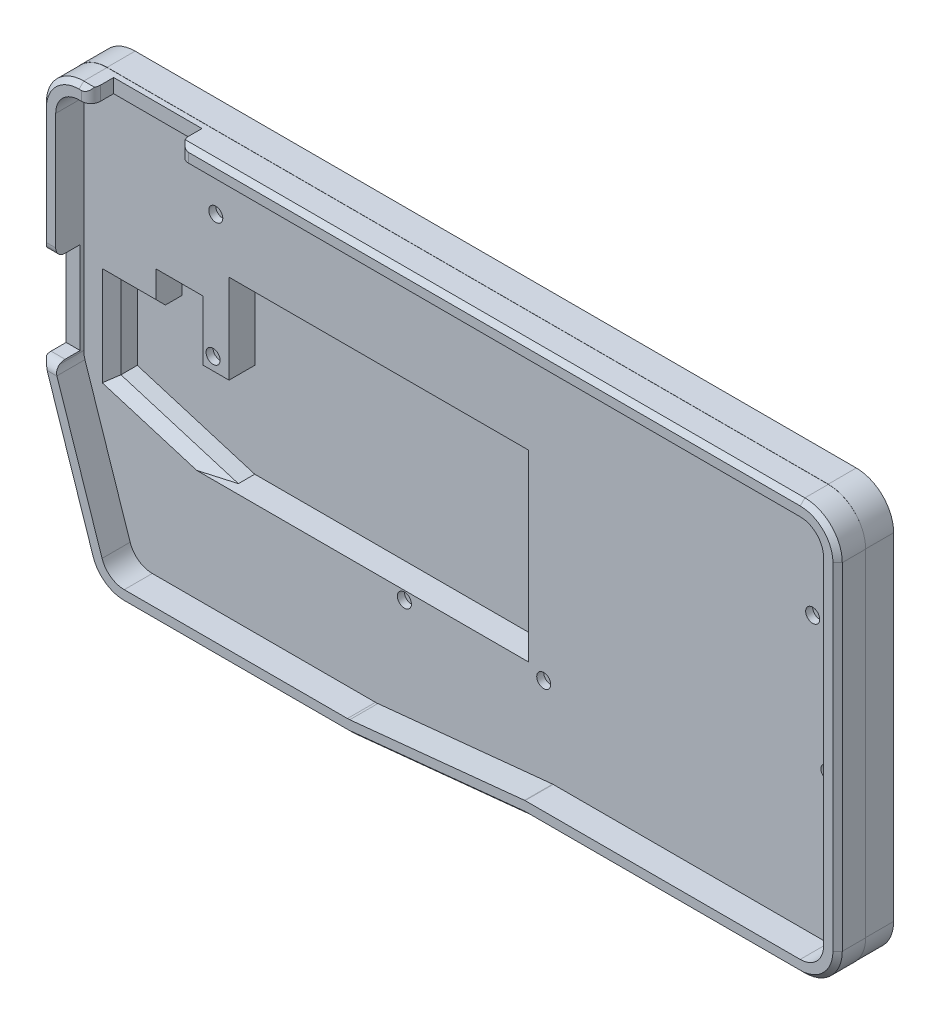
from build123d import *

# Parameters (mm, degrees)
BOSS_EXTRUDE1_DEPTH = 6
SKETCH4_R           = 1
BOSS_EXTRUDE2_DEPTH = 6
SKETCH5_W           = 18.416924118
SKETCH5_H           = 14.207341462
SKETCH5_W_2         = 7.542168924
CUT_EXTRUDE2_DEPTH  = 5.5
BOSS_EXTRUDE3_START = -5.5
SKETCH6_R           = 1
BOSS_EXTRUDE3_DEPTH = 5.5
SKETCH7_R           = 1.5
CUT_EXTRUDE3_DEPTH  = 1.5
SKETCH8_R           = 6
CUT_EXTRUDE4_DEPTH  = 2.5
CHAMFER1_SIZE       = 1
SKETCH9_W           = 18.892930983
SKETCH9_H           = 5.861361118
CUT_EXTRUDE5_DEPTH  = 5
FILLET1_R           = 2
SKETCH10_W          = 6.781572577
SKETCH10_H          = 19.62380987
CUT_EXTRUDE6_DEPTH  = 5
FILLET2_R           = 2
SKETCH11_W          = 9.997758807
SKETCH11_H          = 15.961334235
CUT_EXTRUDE7_DEPTH  = 5.5
SKETCH12_W          = 64.020736218
SKETCH12_H          = 3.376126478
BOSS_EXTRUDE4_DEPTH = 5.5
CUT_EXTRUDE8_DEPTH  = 5.5
CHAMFER2_SIZE       = 2
CHAMFER3_SIZE       = 2
CHAMFER4_SIZE       = 2


with BuildPart() as part:
    # Sketch3 → Boss-Extrude1 (new body)
    with BuildSketch(Plane.XY):
        with BuildLine():
            Line((-83.698447841, 57.444573542), (70.551552159, 57.348317742))
            ThreePointArc((70.551552159, 57.348317742), (76.205179029, 55.0034083), (78.546560098, 49.348319285))
            Line((78.546560098, 49.348319285), (78.546560098, -22.653552215))
            ThreePointArc((78.546560098, -22.653552215), (76.203414347, -28.310406464), (70.546560098, -30.653552215))
            Line((70.546560098, -30.653552215), (11.797913198, -30.653552215))
            Line((11.797913198, -30.653552215), (-25.501951002, -34.413220215))
            ThreePointArc((-25.501951002, -34.413220215), (-25.902594791, -34.443462903), (-26.304251697, -34.453552282))
            Line((-26.304251697, -34.453552282), (-74.041162197, -34.453552282))
            ThreePointArc((-74.041162197, -34.453552282), (-78.718844372, -32.943489837), (-81.6306285, -28.983374648))
            Line((-81.6306285, -28.983374648), (-91.292906294, 0.003458516))
            ThreePointArc((-91.292906294, 0.003458516), (-91.600139587, 1.251822731), (-91.703439931, 2.53328071))
            Line((-91.703439931, 2.53328071), (-91.703439931, 49.44457511))
            ThreePointArc((-91.703439931, 49.44457511), (-89.358528934, 55.103194051), (-83.698447841, 57.444573542))
        make_face()
        with BuildLine():
            Line((-83.700319941, 54.444574123), (70.549680059, 54.348318323))
            ThreePointArc((70.549680059, 54.348318323), (74.083196904, 52.882749939), (75.546560095, 49.348319271))
            Line((75.546560095, 49.348319271), (75.546560095, -22.653552229))
            ThreePointArc((75.546560095, -22.653552229), (74.082093996, -26.189086124), (70.546560098, -27.653552212))
            Line((70.546560098, -27.653552212), (11.697371898, -27.653552212))
            ThreePointArc((11.697371898, -27.653552212), (11.64716478, -27.654813402), (11.597084303, -27.658593757))
            Line((11.597084303, -27.658593757), (-25.802813799, -31.428344747))
            ThreePointArc((-25.802813799, -31.428344747), (-26.053216149, -31.447246424), (-26.304251697, -31.453552285))
            Line((-26.304251697, -31.453552285), (-74.041162197, -31.453552285))
            ThreePointArc((-74.041162197, -31.453552285), (-76.964713558, -30.509763257), (-78.784578638, -28.034691263))
            Line((-78.784578638, -28.034691263), (-88.446856397, 0.952141815))
            ThreePointArc((-88.446856397, 0.952141815), (-88.638877211, 1.732369461), (-88.703439928, 2.53328071))
            Line((-88.703439928, 2.53328071), (-88.703439928, 49.44457511))
            ThreePointArc((-88.703439928, 49.44457511), (-87.237870579, 52.981211921), (-83.700319941, 54.444574123))
        make_face(mode=Mode.SUBTRACT)
    extrude(amount=BOSS_EXTRUDE1_DEPTH)

    # Sketch4 → Boss-Extrude2 (add)
    # profile 1 of 2: a face of its own
    with BuildSketch(Plane.XY):
        with BuildLine():
            Line((-83.709120873, 57.479155754), (70.540879127, 57.382899954))
            ThreePointArc((70.540879127, 57.382899954), (76.194505997, 55.037990512), (78.535887066, 49.382901497))
            Line((78.535887066, 49.382901497), (78.535887066, -22.618970003))
            ThreePointArc((78.535887066, -22.618970003), (76.192741315, -28.275824252), (70.535887066, -30.618970003))
            Line((70.535887066, -30.618970003), (11.787240166, -30.618970003))
            Line((11.787240166, -30.618970003), (-25.512624034, -34.378638003))
            ThreePointArc((-25.512624034, -34.378638003), (-25.913267823, -34.408880691), (-26.314924729, -34.41897007))
            Line((-26.314924729, -34.41897007), (-74.051835229, -34.41897007))
            ThreePointArc((-74.051835229, -34.41897007), (-78.729517404, -32.908907625), (-81.641301532, -28.948792436))
            Line((-81.641301532, -28.948792436), (-91.303579326, 0.038040728))
            ThreePointArc((-91.303579326, 0.038040728), (-91.610812619, 1.286404943), (-91.714112963, 2.567862922))
            Line((-91.714112963, 2.567862922), (-91.714112963, 49.479157322))
            ThreePointArc((-91.714112963, 49.479157322), (-89.369201966, 55.137776263), (-83.709120873, 57.479155754))
        make_face()
        with BuildLine():
            ThreePointArc((-83.710992973, 54.479156335), (-87.248543611, 53.015794133), (-88.71411296, 49.479157322))
            Line((-88.71411296, 49.479157322), (-88.71411296, 2.567862922))
            ThreePointArc((-88.71411296, 2.567862922), (-88.649550243, 1.766951673), (-88.457529429, 0.986724027))
            Line((-88.457529429, 0.986724027), (-78.79525167, -28.000109051))
            ThreePointArc((-78.79525167, -28.000109051), (-76.97538659, -30.475181045), (-74.051835229, -31.418970073))
            Line((-74.051835229, -31.418970073), (-26.314924729, -31.418970073))
            ThreePointArc((-26.314924729, -31.418970073), (-26.063889181, -31.412664212), (-25.813486831, -31.393762535))
            Line((-25.813486831, -31.393762535), (11.586411271, -27.624011544))
            ThreePointArc((11.586411271, -27.624011544), (11.636491748, -27.62023119), (11.686698866, -27.61897))
            Line((11.686698866, -27.61897), (70.535887066, -27.61897))
            ThreePointArc((70.535887066, -27.61897), (74.071420964, -26.154503912), (75.535887062, -22.618970017))
            Line((75.535887062, -22.618970017), (75.535887062, 49.382901483))
            ThreePointArc((75.535887062, 49.382901483), (74.072523872, 52.917332152), (70.539007027, 54.382900535))
            Line((70.539007027, 54.382900535), (-83.710992973, 54.479156335))
        make_face(mode=Mode.SUBTRACT)
    # profile 2 of 2: a face of its own
    with BuildSketch(Plane.XY):
        with BuildLine():
            Line((-83.710992973, 54.479156335), (70.539007027, 54.382900535))
            ThreePointArc((70.539007027, 54.382900535), (74.072523872, 52.917332152), (75.535887062, 49.382901483))
            Line((75.535887062, 49.382901483), (75.535887062, -22.618970017))
            ThreePointArc((75.535887062, -22.618970017), (74.071420964, -26.154503912), (70.535887066, -27.61897))
            Line((70.535887066, -27.61897), (11.686698866, -27.61897))
            ThreePointArc((11.686698866, -27.61897), (11.636491748, -27.62023119), (11.586411271, -27.624011544))
            Line((11.586411271, -27.624011544), (-25.813486831, -31.393762535))
            ThreePointArc((-25.813486831, -31.393762535), (-26.063889181, -31.412664212), (-26.314924729, -31.418970073))
            Line((-26.314924729, -31.418970073), (-74.051835229, -31.418970073))
            ThreePointArc((-74.051835229, -31.418970073), (-76.97538659, -30.475181045), (-78.79525167, -28.000109051))
            Line((-78.79525167, -28.000109051), (-88.457529429, 0.986724027))
            ThreePointArc((-88.457529429, 0.986724027), (-88.649550243, 1.766951673), (-88.71411296, 2.567862922))
            Line((-88.71411296, 2.567862922), (-88.71411296, 49.479157322))
            ThreePointArc((-88.71411296, 49.479157322), (-87.248543611, 53.015794133), (-83.710992973, 54.479156335))
        make_face()
        with Locations((67.215887037, 31.431029922)):
            Circle(SKETCH4_R, mode=Mode.SUBTRACT)
        with Locations((70.485887037, 3.881029922)):
            Circle(SKETCH4_R, mode=Mode.SUBTRACT)
        with Locations((9.685887037, -9.418970078)):
            Circle(SKETCH4_R, mode=Mode.SUBTRACT)
        with Locations((-20.114112963, -9.418970078)):
            Circle(SKETCH4_R, mode=Mode.SUBTRACT)
        with Locations((-61.034112963, 15.281029922)):
            Circle(SKETCH4_R, mode=Mode.SUBTRACT)
        with Locations((-60.464112963, 41.881029922)):
            Circle(SKETCH4_R, mode=Mode.SUBTRACT)
    extrude(amount=-BOSS_EXTRUDE2_DEPTH)

    # Sketch5 → Cut-Extrude2 (cut)
    with BuildSketch(Plane.XY):
        with Locations((-66.833428189, 5.461527447)):
            Rectangle(SKETCH5_W, SKETCH5_H)
        with Locations((-53.853881668, 5.461527447)):
            Rectangle(SKETCH5_W_2, SKETCH5_H)
        Polygon((6.395770088, 35.016305674), (-57.62496613, 35.016305674), (-57.62496613, 12.565198178), (-50.082797206, 12.565198178), (-50.082797206, -1.642143284), (-57.62496613, -1.642143284), (-57.62496613, -7.605718712), (6.395770088, -7.605718712), align=None)
    extrude(amount=-CUT_EXTRUDE2_DEPTH, mode=Mode.SUBTRACT)

    # Sketch6 → Boss-Extrude3 (add)
    with BuildSketch(Plane(origin=(0, 0, -6), x_dir=(-1, 0, 0), z_dir=(0, 0, -1)).offset(BOSS_EXTRUDE3_START)):
        with Locations(Location((-67.215887037, 31.431029922, 0), (0, 0, 180))):
            Circle(SKETCH6_R)
        with Locations(Location((-70.485887037, 3.881029922, 0), (0, 0, 180))):
            Circle(SKETCH6_R)
        with Locations(Location((-9.685887037, -9.418970078, 0), (0, 0, 180))):
            Circle(SKETCH6_R)
        with Locations(Location((20.114112963, -9.418970078, 0), (0, 0, 180))):
            Circle(SKETCH6_R)
        with Locations(Location((61.034112963, 15.281029922, 0), (0, 0, 180))):
            Circle(SKETCH6_R)
        with Locations(Location((60.464112963, 41.881029922, 0), (0, 0, 180))):
            Circle(SKETCH6_R)
    extrude(amount=BOSS_EXTRUDE3_DEPTH)

    # Sketch7 → Cut-Extrude3 (cut)
    with BuildSketch(Plane.XY):
        with Locations((-60.464112963, 41.881029922)):
            Circle(SKETCH7_R)
        with Locations((-61.034112963, 15.281029922)):
            Circle(SKETCH7_R)
        with Locations((-20.114112963, -9.418970078)):
            Circle(SKETCH7_R)
        with Locations((9.685887037, -9.418970078)):
            Circle(SKETCH7_R)
        with Locations((70.485887037, 3.881029922)):
            Circle(SKETCH7_R)
        with Locations((67.215887037, 31.431029922)):
            Circle(SKETCH7_R)
    extrude(amount=-CUT_EXTRUDE3_DEPTH, mode=Mode.SUBTRACT)

    # Sketch8 → Cut-Extrude4 (cut)
    with BuildSketch(Plane(origin=(0, 0, -6), x_dir=(-1, 0, 0), z_dir=(0, 0, -1))):
        with Locations((-70.535887037, 49.382901483)):
            Circle(SKETCH8_R)
        with Locations((-70.535887037, -22.163858729)):
            Circle(SKETCH8_R)
        with Locations((83.75945845, 49.382901483)):
            Circle(SKETCH8_R)
        with Locations((73.586300366, -25.671844276)):
            Circle(SKETCH8_R)
    extrude(amount=-CUT_EXTRUDE4_DEPTH, mode=Mode.SUBTRACT)

    # Chamfer1
    chamfer1_edges = [part.edges().sort_by_distance(p)[0] for p in [
        (-91.600139587, 1.251822731, 6),
        (-86.461767397, -14.489958066, 6),
        (-78.718844372, -32.943489837, 6),
        (-50.172706947, -34.453552282, 6),
        (-25.902594791, -34.443462903, 6),
        (-6.852018902, -32.533386215, 6),
        (41.172236648, -30.653552215, 6),
        (76.203414347, -28.310406464, 6),
        (78.546560098, 13.347383535, 6),
        (76.205179029, 55.0034083, 6),
        (-89.358528934, 55.103194051, 6),
        (-6.573447841, 57.396445642, 6),
        (-91.703439931, 25.98892791, 6),
    ]]
    chamfer(chamfer1_edges, length=CHAMFER1_SIZE)

    # Sketch9 → Cut-Extrude5 (cut)
    with BuildSketch(Plane(origin=(0.035814222, 57.392321299, 0), x_dir=(0.9999998052966842, -0.0006240245138326787, 0), z_dir=(0.0006240245138326787, 0.9999998052966842, 0))):
        with Locations((-71.746565454, -4.083255452)):
            Rectangle(SKETCH9_W, SKETCH9_H)
    extrude(amount=-CUT_EXTRUDE5_DEPTH, mode=Mode.SUBTRACT)

    # Fillet1
    fillet1_edges = [part.edges().sort_by_distance(p)[0] for p in [
        (-62.265521659, 55.431198477, 6),
        (-81.158448963, 55.442988129, 6),
    ]]
    fillet(fillet1_edges, radius=FILLET1_R)

    # Sketch10 → Cut-Extrude6 (cut)
    with BuildSketch(Plane.ZY.offset(91.703439931)):
        with Locations((4.158048933, 12.711198082)):
            Rectangle(SKETCH10_W, SKETCH10_H)
    extrude(amount=-CUT_EXTRUDE6_DEPTH, mode=Mode.SUBTRACT)

    # Fillet2
    fillet2_edges = [part.edges().sort_by_distance(p)[0] for p in [
        (-89.703439929, 2.899293147, 6),
        (-89.703439929, 22.523103017, 6),
    ]]
    fillet(fillet2_edges, radius=FILLET2_R)

    # Sketch11 → Cut-Extrude7 (cut)
    with BuildSketch(Plane.XY):
        with Locations((-68.236622408, 17.388678305)):
            Rectangle(SKETCH11_W, SKETCH11_H)
    extrude(amount=-CUT_EXTRUDE7_DEPTH, mode=Mode.SUBTRACT)

    # Sketch12 → Boss-Extrude4 (add)
    with BuildSketch(Plane.XY.offset(-5.5)):
        with Locations((-25.614598021, 33.328242435)):
            Rectangle(SKETCH12_W, SKETCH12_H)
    extrude(amount=BOSS_EXTRUDE4_DEPTH)

    # Sketch13 → Cut-Extrude8 (cut)
    with BuildSketch(Plane.XY):
        Polygon((-82.744925302, 17.678852462), (-82.744925302, 0), (-57.62496613, -7.605718712), (-57.62496613, -1.642143284), (-76.041890248, -1.642143284), (-76.041890248, 12.565198178), (-73.235501811, 12.565198178), (-73.235501811, 17.678852462), align=None)
    extrude(amount=-CUT_EXTRUDE8_DEPTH, mode=Mode.SUBTRACT)

    # Chamfer2
    chamfer2_edges = [part.edges().sort_by_distance(p)[0] for p in [
        (-82.744925302, 8.839426231, 0),
    ]]
    chamfer(chamfer2_edges, length=CHAMFER2_SIZE)

    # Chamfer3
    chamfer3_edges = [part.edges().sort_by_distance(p)[0] for p in [
        (-78.990213556, 17.678852462, 0),
    ]]
    chamfer(chamfer3_edges, length=CHAMFER3_SIZE)

    # Chamfer4
    chamfer4_edges = [part.edges().sort_by_distance(p)[0] for p in [
        (-71.184945716, -3.500083438, 0),
    ]]
    chamfer(chamfer4_edges, length=CHAMFER4_SIZE)


solid = part.part
